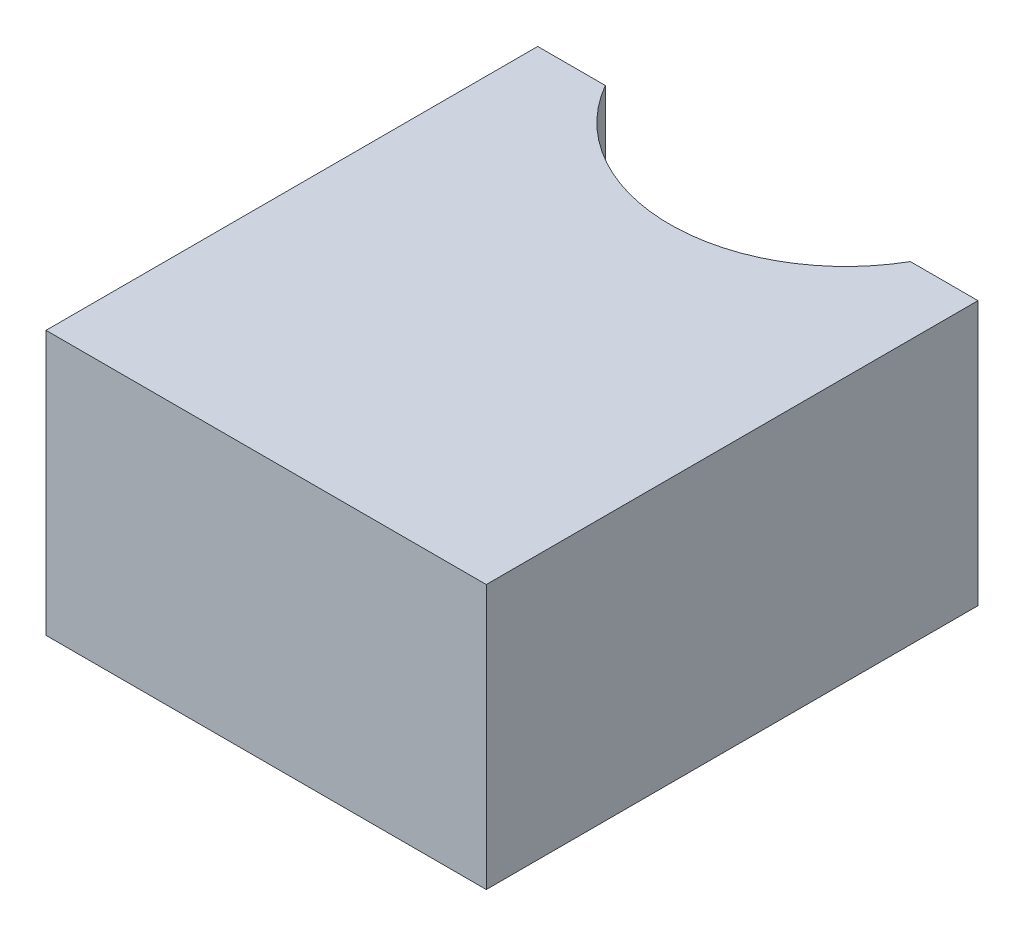
from build123d import *

# Parameters (mm, degrees)
SKETCH1_W           = 31.75
SKETCH1_H           = 19.05
BOSS_EXTRUDE1_DEPTH = 35.4584
SKETCH2_R           = 12.7
CUT_EXTRUDE1_DEPTH  = 44.269114338


with BuildPart() as part:
    # Sketch1 → Boss-Extrude1 (new body)
    with BuildSketch(Plane.XY):
        Rectangle(SKETCH1_W, SKETCH1_H)
    extrude(amount=BOSS_EXTRUDE1_DEPTH)

    # Sketch2 → Cut-Extrude1 (cut, through all)
    with BuildSketch(Plane(origin=(0, 9.525, 0), x_dir=(1, 0, 0), z_dir=(0, 1, 0))):
        with Locations((0, 6.35)):
            Circle(SKETCH2_R)
    extrude(amount=-CUT_EXTRUDE1_DEPTH, mode=Mode.SUBTRACT)


solid = part.part
